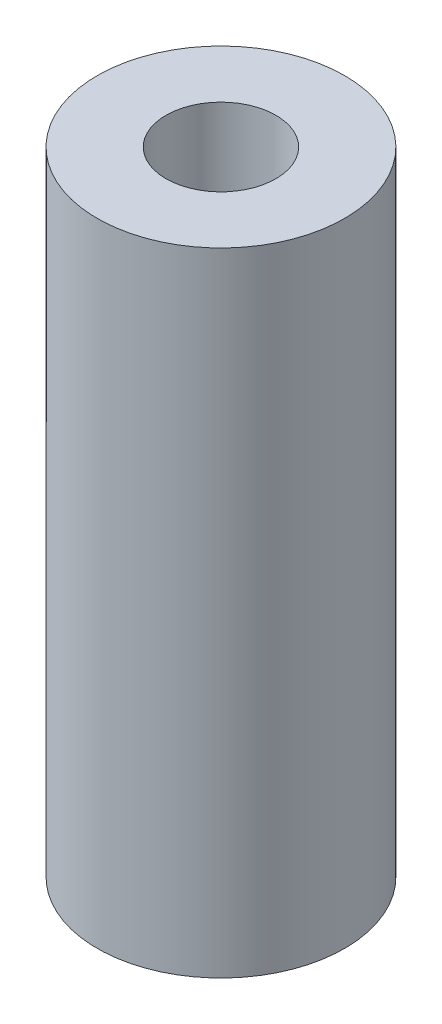
from build123d import *

# Parameters (mm, degrees)
ESQUISSE1_R             = 9
BOSS_EXTRU_1_DEPTH      = 23
ESQUISSE2_R             = 9
ESQUISSE2_R_2           = 4.5
ENL_V_MAT_EXTRU_2_DEPTH = 27.286878856
ESQUISSE3_R             = 1.5
ENL_V_MAT_EXTRU_3_DEPTH = 5
ESQUISSE4_R             = 2
ENL_V_MAT_EXTRU_4_DEPTH = 5


with BuildPart() as part:
    # Esquisse1 → Boss.-Extru.1 (new body)
    with BuildSketch(Plane(origin=(0, 0, 0), x_dir=(1, 0, 0), z_dir=(0, 1, 0))):
        with Locations(Location((0, 0, 0), (0, 0, 270))):
            Circle(ESQUISSE1_R)
    extrude(amount=BOSS_EXTRU_1_DEPTH)

    # Esquisse2 → Enlèv. mat.-Extru.2 (cut, through all)
    with BuildSketch(Plane(origin=(0, 0, 0), x_dir=(-1, 0, 0), z_dir=(0, -1, 0))):
        Circle(ESQUISSE2_R)
        with Locations(Location((0, 0, 0), (0, 0, 90))):
            Circle(ESQUISSE2_R_2, mode=Mode.SUBTRACT)
    extrude(amount=-ENL_V_MAT_EXTRU_2_DEPTH, mode=Mode.SUBTRACT)

    # Esquisse3 → Enlèv. mat.-Extru.3 (cut)
    with BuildSketch(Plane(origin=(0, 0, 0), x_dir=(-1, 0, 0), z_dir=(0, -1, 0))):
        with Locations(Location((0, 0, 0), (0, 0, 90))):
            Circle(ESQUISSE3_R)
    extrude(amount=-ENL_V_MAT_EXTRU_3_DEPTH, mode=Mode.SUBTRACT)

    # Esquisse4 → Enlèv. mat.-Extru.4 (cut)
    with BuildSketch(Plane(origin=(0, 23, 0), x_dir=(1, 0, 0), z_dir=(0, 1, 0))):
        with Locations(Location((0, 0, 0), (0, 0, 270))):
            Circle(ESQUISSE4_R)
    extrude(amount=-ENL_V_MAT_EXTRU_4_DEPTH, mode=Mode.SUBTRACT)


solid = part.part
